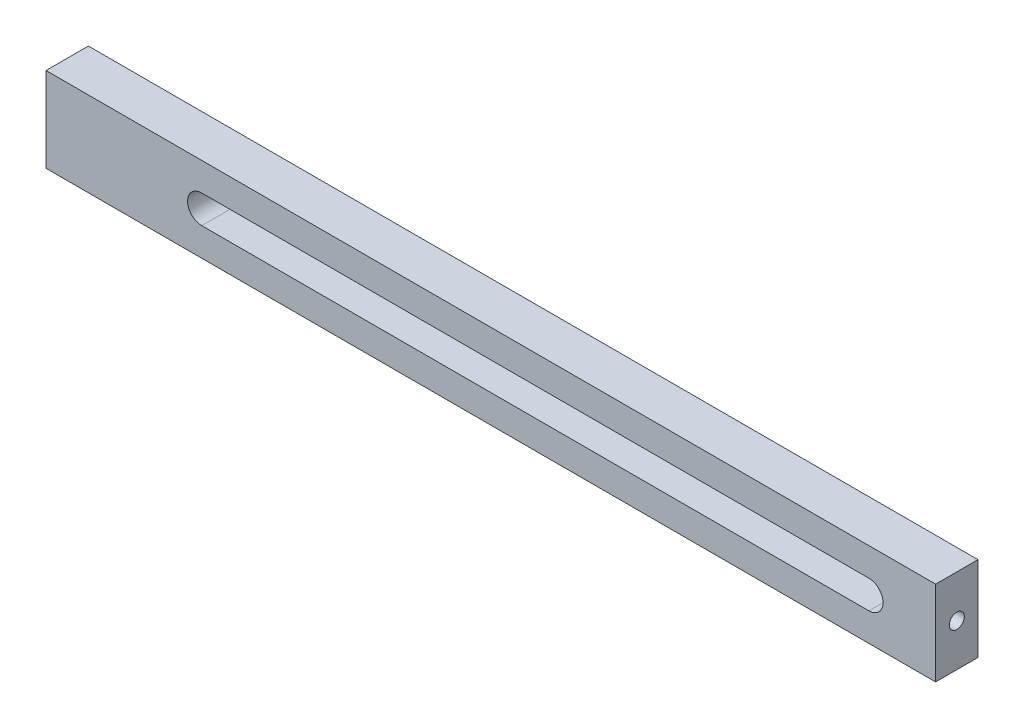
from build123d import *

# Parameters (mm, degrees)
CROQUIS1_W                         = 400
CROQUIS1_H                         = 38.1
SALIENTE_EXTRUIR1_DEPTH            = 9.525
TALADRO_DE_MARGEN_PARA_1_41_REACH  = 402.567
TALADRO_DE_MARGEN_PARA_1_41_BORE_R = 3.3782
TALADRO_ROSCADO_7_16_141_D         = 9.3472
TALADRO_ROSCADO_7_16_141_DEPTH     = 20
TALADRO_ROSCADO_7_16_141_TIP       = 2.808182189


with BuildPart() as part:
    # Croquis1 → Saliente-Extruir1 (new, symmetric)
    with BuildSketch(Plane.XY):
        Rectangle(CROQUIS1_W, CROQUIS1_H)
        with BuildLine():
            Line((-130, 6.35), (170, 6.35))
            ThreePointArc((170, 6.35), (176.35, 0), (170, -6.35))
            Line((170, -6.35), (-130, -6.35))
            ThreePointArc((-130, -6.35), (-136.35, 0), (-130, 6.35))
        make_face(mode=Mode.SUBTRACT)
    extrude(amount=SALIENTE_EXTRUIR1_DEPTH, both=True)

    # Taladro de margen para 1/41 bore → Taladro de margen para 1/41 (cut, up to next)
    with BuildSketch(Plane(origin=(200, 0, 0), x_dir=(0, 0, -1), z_dir=(1, 0, 0)), mode=Mode.PRIVATE) as taladro_de_margen_para_1_41_sk1:
        Circle(TALADRO_DE_MARGEN_PARA_1_41_BORE_R)
    taladro_de_margen_para_1_41_tool1 = extrude(taladro_de_margen_para_1_41_sk1.sketch, amount=-TALADRO_DE_MARGEN_PARA_1_41_REACH, mode=Mode.PRIVATE) & part.part
    add(taladro_de_margen_para_1_41_tool1.solids().sort_by_distance((200, 0, 0))[0], mode=Mode.SUBTRACT)

    # Taladro roscado 7/16-141
    with Locations(Plane.ZY.offset(200)):
        with Locations((0, 9), (0, -9)):
            Hole(TALADRO_ROSCADO_7_16_141_D / 2, depth=TALADRO_ROSCADO_7_16_141_DEPTH)
            with Locations((0, 0, -(TALADRO_ROSCADO_7_16_141_DEPTH + TALADRO_ROSCADO_7_16_141_TIP / 2))):  # 118° drill point
                Cone(0, TALADRO_ROSCADO_7_16_141_D / 2, TALADRO_ROSCADO_7_16_141_TIP, mode=Mode.SUBTRACT)


solid = part.part
